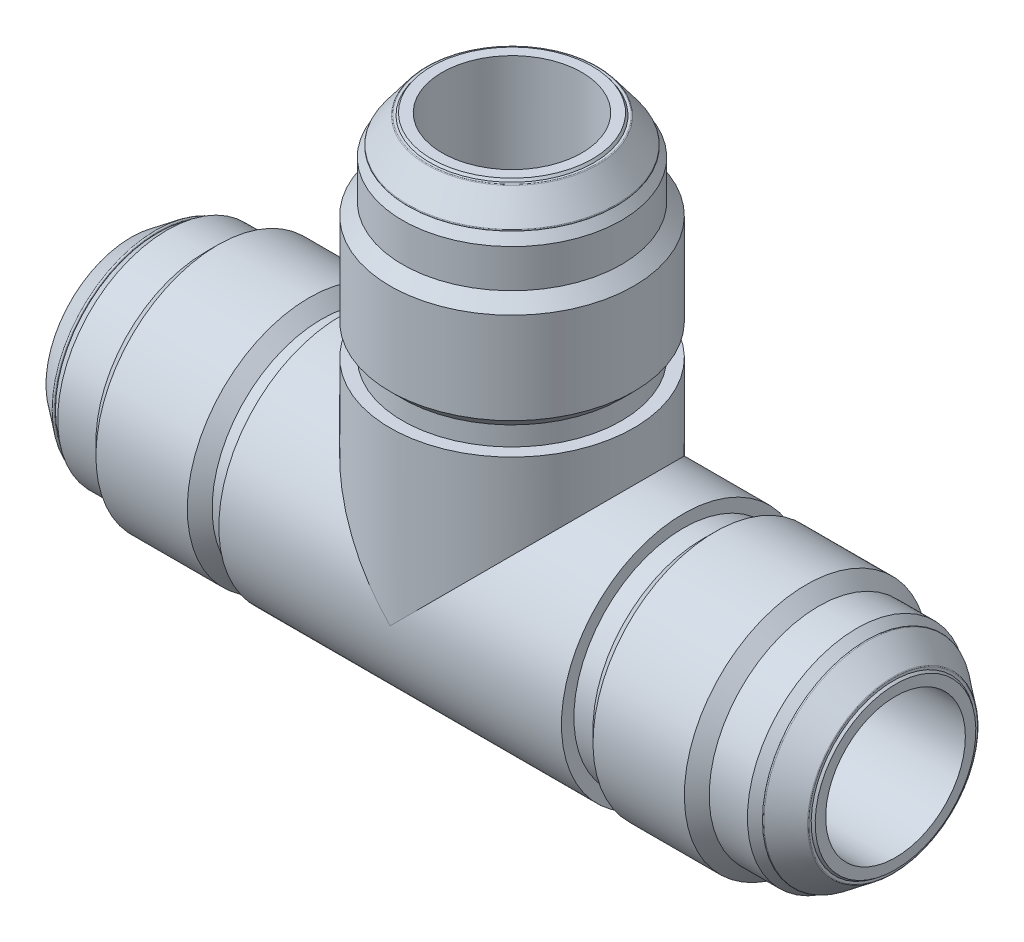
from build123d import *

# Parameters (mm, degrees)
SKETCH2_R           = 13.49375
EXTRUDE1_DEPTH      = 23.495
SKETCH15_R          = 13.49375
BOSS_EXTRUDE1_DEPTH = 18.970625
SKETCH16_R          = 7.7343
CUT_EXTRUDE1_DEPTH  = 47.556330233
CIRPATTERN1_COUNT   = 3
CIRPATTERN1_ANGLE   = 180
SKETCH17_R          = 7.7343
CUT_EXTRUDE2_DEPTH  = 96.909998552
CUT_EXTRUDE3_REACH  = 73.532
SKETCH18_R          = 7.7343


with BuildPart() as part:
    # Sketch2 → Extrude1 (new body)
    with BuildSketch(Plane(origin=(-42.465625, 0, 0), x_dir=(0, 0, -1), z_dir=(1, 0, 0))):
        Circle(SKETCH2_R)
    extrude(amount=EXTRUDE1_DEPTH)

    # Sketch5 → Cut-Revolve1 (revolve, cut)
    with BuildSketch(Plane.XY):
        with BuildLine():
            Line((-38.186582679, 12.118934671), (-33.953249346, 12.118934671))
            Line((-33.953249346, 12.118934671), (-32.578434017, 13.49375))
            Line((-32.578434017, 13.49375), (-42.465625, 13.49375))
            Line((-42.465625, 13.49375), (-42.465625, 8.894445))
            Line((-42.465625, 8.894445), (-42.211625, 9.085847729))
            Line((-42.211625, 9.085847729), (-42.211625, 9.340570322))
            ThreePointArc((-42.211625, 9.340570322), (-42.198281664, 9.397237444), (-42.161055508, 9.441997031))
            Line((-42.161055508, 9.441997031), (-39.406013187, 11.518070331))
            ThreePointArc((-39.406013187, 11.518070331), (-39.272915557, 11.530300285), (-39.202582679, 11.416643621))
            Line((-39.202582679, 11.416643621), (-39.202582679, 11.353323757))
            Line((-39.202582679, 11.353323757), (-38.186582679, 12.118934671))
        make_face()
        Polygon((-18.970625, 12.118934671), (-21.087291667, 12.118934671), (-22.462106995, 13.49375), (-18.970625, 13.49375), align=None)
    revolve(axis=Axis((0, 0, 0), (-1, 0, 0)), mode=Mode.SUBTRACT)

    # Sketch15 → Boss-Extrude1 (add)
    with BuildSketch(Plane(origin=(-18.970625, 0, 0), x_dir=(0, 0, -1), z_dir=(1, 0, 0))):
        with Locations(Location((0, 0, 0), (0, 0, 90))):
            Circle(SKETCH15_R)
    extrude(amount=BOSS_EXTRUDE1_DEPTH)

    # Sketch16 → Cut-Extrude1 (cut, through all)
    with BuildSketch(Plane(origin=(0, 0, 0), x_dir=(0, 0, -1), z_dir=(1, 0, 0))):
        Circle(SKETCH16_R)
    extrude(amount=-CUT_EXTRUDE1_DEPTH, mode=Mode.SUBTRACT)


with BuildPart() as cirpattern1_1:
    # CirPattern1: pattern copy
    add(part.part.rotate(Axis((0, 0, 0), (0, 0, -1)), 1 * CIRPATTERN1_ANGLE / (CIRPATTERN1_COUNT - 1)))

    # Sketch17 → Cut-Extrude2 (cut, through all)
    with BuildSketch(Plane.ZY.offset(42.465625)):
        with Locations(Location((0, 0, 0), (0, 0, 180))):
            Circle(SKETCH17_R)
    extrude(amount=-CUT_EXTRUDE2_DEPTH, mode=Mode.SUBTRACT)


with BuildPart() as cirpattern1_2:
    # CirPattern1: pattern copy
    add(part.part.rotate(Axis((0, 0, 0), (0, 0, -1)), 2 * CIRPATTERN1_ANGLE / (CIRPATTERN1_COUNT - 1)))


with BuildPart() as cirpattern1_1_1:
    add(cirpattern1_1.part)

    # Combine1: union part, CirPattern1_2
    add(part.part)
    add(cirpattern1_2.part)

    # Sketch18 → Cut-Extrude3 (cut, up to next)
    with BuildSketch(Plane(origin=(0, 42.465625, 0), x_dir=(1, 0, 0), z_dir=(0, 1, 0)), mode=Mode.PRIVATE) as cut_extrude3_sk1:
        with Locations(Location((0, 0, 0), (0, 0, 90))):
            Circle(SKETCH18_R)
    cut_extrude3_tool1 = extrude(cut_extrude3_sk1.sketch, amount=-CUT_EXTRUDE3_REACH, mode=Mode.PRIVATE) & cirpattern1_1_1.part
    add(cut_extrude3_tool1.solids().sort_by_distance((0, 42.465625, 0))[0], mode=Mode.SUBTRACT)


solid = cirpattern1_1_1.part
